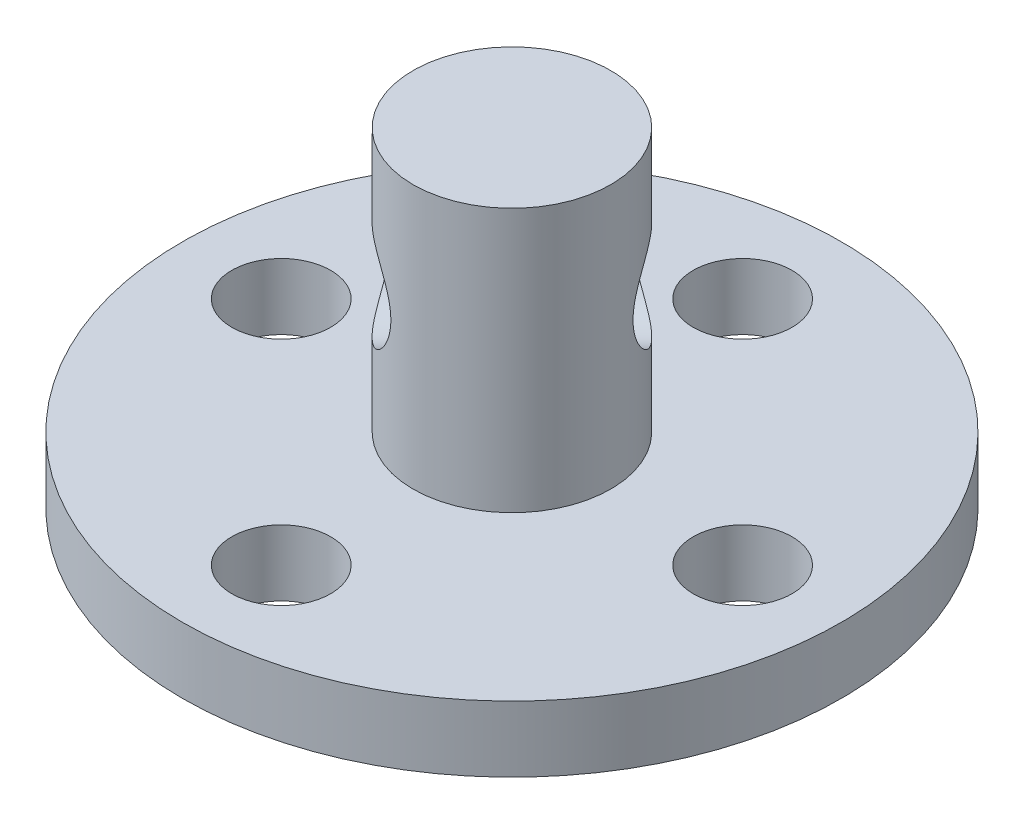
from build123d import *

# Parameters (mm, degrees)
SKETCH_1_R          = 10
SKETCH_1_R_2        = 3
SKETCH_1_R_3        = 1.5
EXTRUDE_1_DEPTH     = 2
SKETCH_2_R          = 3
EXTRUDE_2_DEPTH     = 10
SKETCH_5_R          = 1.5
CUT_EXTRUDE_3_DEPTH = 5


with BuildPart() as part:
    # 草图1 → 凸台-拉伸1 (new body)
    with BuildSketch(Plane(origin=(0, 0, 0), x_dir=(1, 0, 0), z_dir=(0, 1, 0))):
        Circle(SKETCH_1_R)
        Circle(SKETCH_1_R_2, mode=Mode.SUBTRACT)
        with Locations((0, 7)):
            Circle(SKETCH_1_R_3, mode=Mode.SUBTRACT)
        with Locations((7, 0)):
            Circle(SKETCH_1_R_3, mode=Mode.SUBTRACT)
        with Locations((0, -7)):
            Circle(SKETCH_1_R_3, mode=Mode.SUBTRACT)
        with Locations((-7, 0)):
            Circle(SKETCH_1_R_3, mode=Mode.SUBTRACT)
    extrude(amount=EXTRUDE_1_DEPTH)

    # 草图2 → 凸台-拉伸2 (add)
    with BuildSketch(Plane(origin=(0, 0, 0), x_dir=(1, 0, 0), z_dir=(0, 1, 0))):
        Circle(SKETCH_2_R)
    extrude(amount=EXTRUDE_2_DEPTH)

    # 草图5 → 切除-拉伸3 (cut, symmetric)
    with BuildSketch(Plane(origin=(0, 0, 0), x_dir=(0, 1, 0), z_dir=(0.7071067811865438, 0, -0.7071067811865512))):
        with Locations((6, 0)):
            Circle(SKETCH_5_R)
    extrude(amount=CUT_EXTRUDE_3_DEPTH, both=True, mode=Mode.SUBTRACT)


solid = part.part
